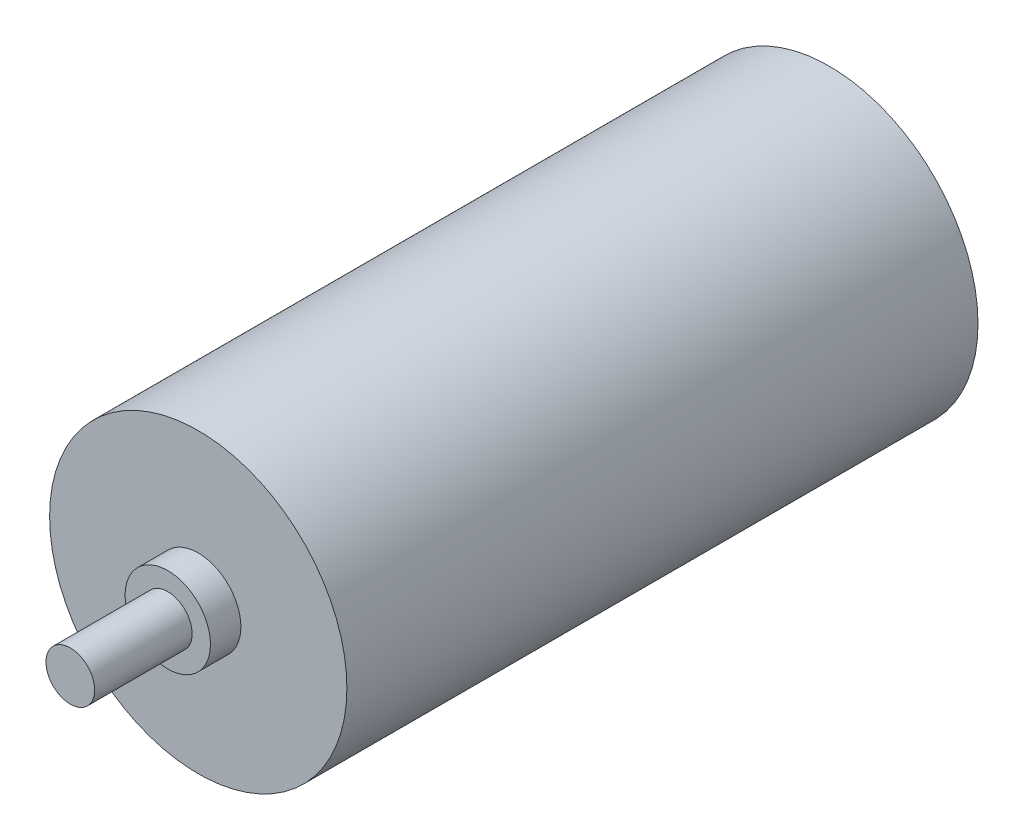
from build123d import *

# Parameters (mm, degrees)
SKETCH_1_R      = 12.2
EXTRUDE_1_DEPTH = 51.8
SKETCH_5_R      = 3.5
EXTRUDE_3_DEPTH = 2.5
SKETCH_6_R      = 2
EXTRUDE_4_DEPTH = 8


with BuildPart() as part:
    # 草图1 → 凸台-拉伸1 (new body)
    with BuildSketch(Plane.XY):
        with Locations(Location((0, 0, 0), (0, 0, 180))):
            Circle(SKETCH_1_R)
    extrude(amount=EXTRUDE_1_DEPTH)

    # 草图5 → 凸台-拉伸3 (add)
    with BuildSketch(Plane.XY.offset(51.8)):
        Circle(SKETCH_5_R)
    extrude(amount=EXTRUDE_3_DEPTH)

    # 草图6 → 凸台-拉伸4 (add)
    with BuildSketch(Plane.XY.offset(54.3)):
        Circle(SKETCH_6_R)
    extrude(amount=EXTRUDE_4_DEPTH)


solid = part.part
